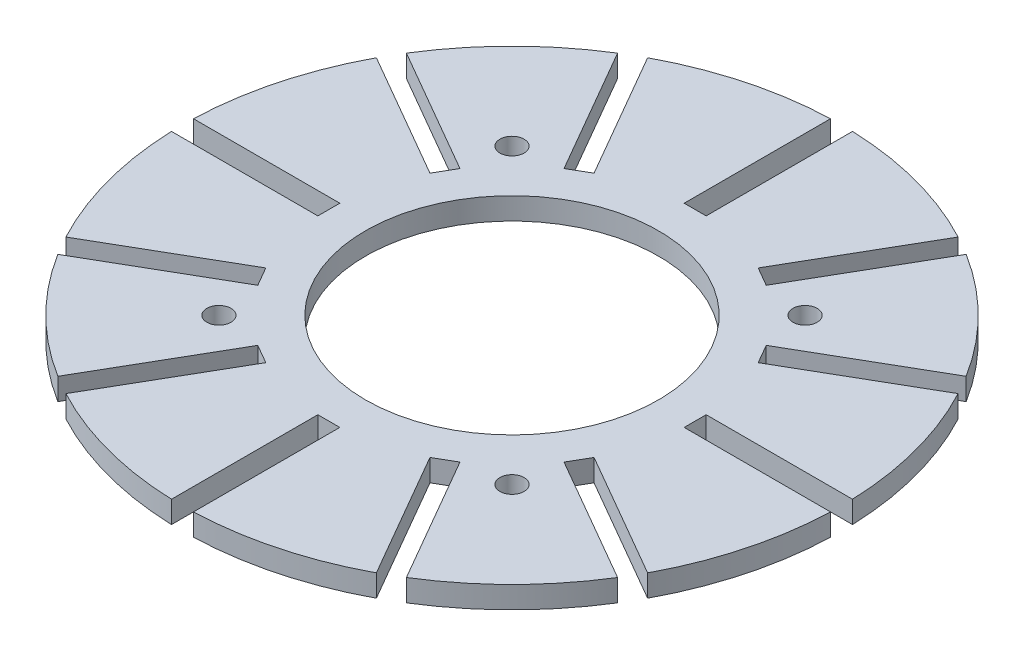
from build123d import *

# Parameters (mm, degrees)
SKETCH1_R           = 45
SKETCH1_R_2         = 10
BOSS_EXTRUDE1_DEPTH = 1.5
SKETCH2_R           = 1.65
CUT_EXTRUDE1_DEPTH  = 10
SKETCH3_W           = 3
SKETCH3_H           = 20
SKETCH3_W_2         = 20
SKETCH3_H_2         = 3
CUT_EXTRUDE2_DEPTH  = 10
SKETCH4_R           = 20
CUT_EXTRUDE3_DEPTH  = 10


with BuildPart() as part:
    # Sketch1 → Boss-Extrude1 (new, symmetric)
    with BuildSketch(Plane(origin=(0, 0, 0), x_dir=(1, 0, 0), z_dir=(0, 1, 0))):
        with Locations(Location((0, 0, 0), (0, 0, 270))):
            Circle(SKETCH1_R)
        with Locations(Location((0, 0, 0), (0, 0, 270))):
            Circle(SKETCH1_R_2, mode=Mode.SUBTRACT)
    extrude(amount=BOSS_EXTRUDE1_DEPTH, both=True)

    # Sketch2 → Cut-Extrude1 (cut)
    with BuildSketch(Plane(origin=(0, 1.5, 0), x_dir=(1, 0, 0), z_dir=(0, 1, 0))):
        with Locations(Location((-20, -20, 0), (0, 0, 270))):
            Circle(SKETCH2_R)
        with Locations(Location((-20, 20, 0), (0, 0, 270))):
            Circle(SKETCH2_R)
        with Locations(Location((20, 20, 0), (0, 0, 270))):
            Circle(SKETCH2_R)
        with Locations(Location((20, -20, 0), (0, 0, 270))):
            Circle(SKETCH2_R)
    extrude(amount=-CUT_EXTRUDE1_DEPTH, mode=Mode.SUBTRACT)

    # Sketch3 → Cut-Extrude2 (cut)
    with BuildSketch(Plane(origin=(0, 1.5, 0), x_dir=(1, 0, 0), z_dir=(0, 1, 0))):
        with Locations((0, -35)):
            Rectangle(SKETCH3_W, SKETCH3_H)
        Polygon((-13.799038106, -20.900635095), (-23.799038106, -38.22114317), (-21.200961894, -39.72114317), (-11.200961894, -22.400635095), align=None)
        Polygon((-22.400635095, -11.200961894), (-39.72114317, -21.200961894), (-38.22114317, -23.799038106), (-20.900635095, -13.799038106), align=None)
        with Locations((-35, 0)):
            Rectangle(SKETCH3_W_2, SKETCH3_H_2)
        Polygon((-20.900635095, 13.799038106), (-38.22114317, 23.799038106), (-39.72114317, 21.200961894), (-22.400635095, 11.200961894), align=None)
        Polygon((-11.200961894, 22.400635095), (-21.200961894, 39.72114317), (-23.799038106, 38.22114317), (-13.799038106, 20.900635095), align=None)
        with Locations((0, 35)):
            Rectangle(SKETCH3_W, SKETCH3_H)
        Polygon((13.799038106, 20.900635095), (23.799038106, 38.22114317), (21.200961894, 39.72114317), (11.200961894, 22.400635095), align=None)
        Polygon((22.400635095, 11.200961894), (39.72114317, 21.200961894), (38.22114317, 23.799038106), (20.900635095, 13.799038106), align=None)
        with Locations((35, 0)):
            Rectangle(SKETCH3_W_2, SKETCH3_H_2)
        Polygon((20.900635095, -13.799038106), (38.22114317, -23.799038106), (39.72114317, -21.200961894), (22.400635095, -11.200961894), align=None)
        Polygon((11.200961894, -22.400635095), (21.200961894, -39.72114317), (23.799038106, -38.22114317), (13.799038106, -20.900635095), align=None)
    extrude(amount=-CUT_EXTRUDE2_DEPTH, mode=Mode.SUBTRACT)

    # Sketch4 → Cut-Extrude3 (cut)
    with BuildSketch(Plane(origin=(0, 1.5, 0), x_dir=(1, 0, 0), z_dir=(0, 1, 0))):
        with Locations(Location((0, 0, 0), (0, 0, 270))):
            Circle(SKETCH4_R)
    extrude(amount=-CUT_EXTRUDE3_DEPTH, mode=Mode.SUBTRACT)


solid = part.part
